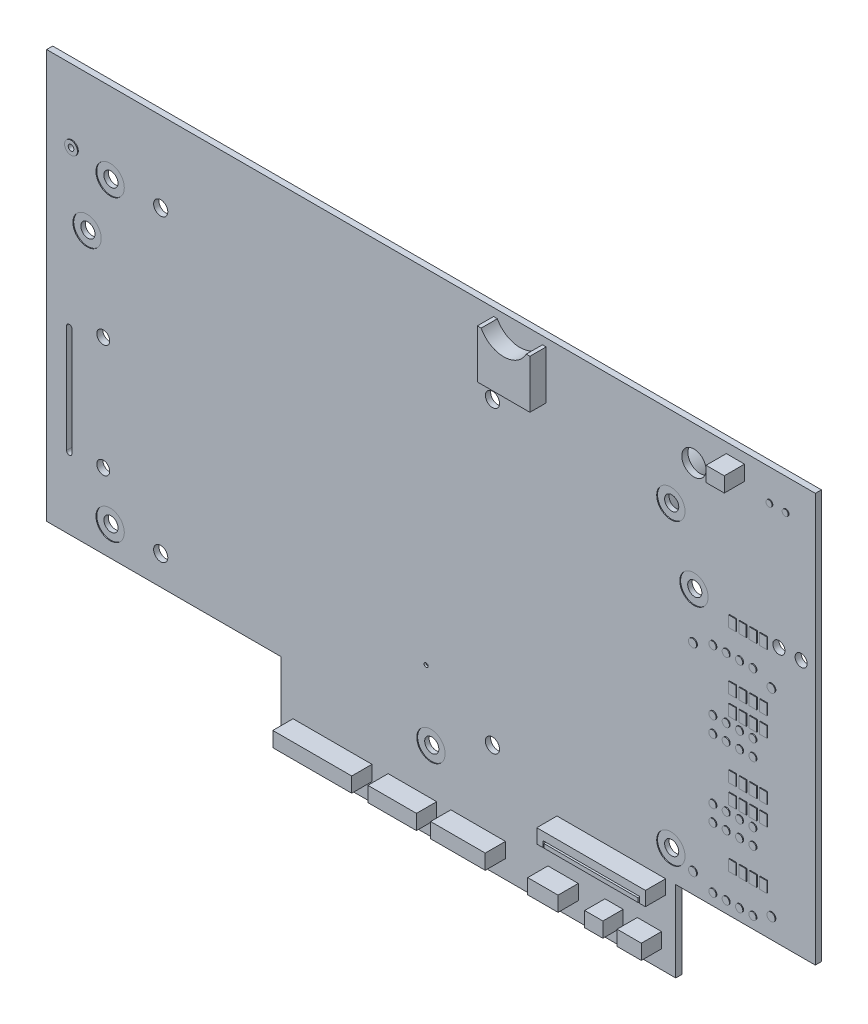
from build123d import *

# Parameters (mm, degrees)
BASE_EXTRUSION_DEPTH     = 1.5
ESQUISSE2_R              = 1.75
ENL_V_MAT_EXTRU_1_DEPTH  = 2
ESQUISSE5_R              = 1.75
ENL_V_MAT_EXTRU_2_DEPTH  = 3
ESQUISSE7_R              = 8
BOSS_EXTRU_1_DEPTH       = 14.5
ESQUISSE10_R             = 0.5
ENL_V_MAT_EXTRU_4_DEPTH  = 0.5
BOSS_EXTRU_6_DEPTH       = 4
ESQUISSE16_W             = 23.306113507
ESQUISSE16_H             = 1
BOSS_EXTRU_7_DEPTH       = 5
ESQUISSE17_R             = 8
ENL_V_MAT_EXTRU_6_DEPTH  = 0.2
ESQUISSE18_R             = 3.5
ENL_V_MAT_EXTRU_7_DEPTH  = 0.2
ENL_V_START              = -0.2
ESQUISSE19_R             = 3.5
ENL_V_MAT_EXTRU_8_DEPTH  = 0.2
ESQUISSE22_W             = 7.5
ESQUISSE22_H             = 3.7
ESQUISSE22_W_2           = 4.5
ESQUISSE22_W_3           = 6
ESQUISSE22_W_4           = 13.5
ESQUISSE22_W_5           = 12
ESQUISSE22_W_6           = 19.5
EXTRUSION1_DEPTH         = 5
ENL_V_MAT_EXTRU_11_DEPTH = 3
ESQUISSE29_R             = 0.9
EXTRUSION3_DEPTH         = 0.2
ESQUISSE31_W             = 1.8
ESQUISSE31_H             = 2.7
EXTRUSION4_DEPTH         = 0.2
ESQUISSE32_R             = 1
EXTRUSION5_DEPTH         = 0.2
ESQUISSE33_R             = 1.75
ENL_V_MAT_EXTRU_17_DEPTH = 4
ESQUISSE34_R             = 3.5
ENL_V_MAT_EXTRU_18_DEPTH = 0.2
ESQUISSE28_R             = 0.75
EXTRUSION7_DEPTH         = 0.2
ENL_V_MAT_EXTRU_19_DEPTH = 10
ESQUISSE37_R             = 1.6
EXTRUSION8_DEPTH         = 0.2
ESQUISSE38_R             = 0.7
ENL_V_MAT_EXTRU_20_DEPTH = 3
ESQUISSE39_R             = 1.6
ESQUISSE39_R_2           = 0.7
EXTRUSION9_DEPTH         = 0.2
ESQUISSE40_R             = 1.6
ENL_V_MAT_EXTRU_21_DEPTH = 10
ESQUISSE41_R             = 3
ENL_V_MAT_EXTRU_22_DEPTH = 10


with BuildPart() as part:
    # Esquisse1 → Base-Extrusion (new body)
    with BuildSketch(Plane.XY):
        Polygon((122.14228109, -27.413176144), (122.14228109, 73.586823856), (-67.85771891, 73.586823856), (-67.85771891, -27.413176144), (-9.945816536, -27.413176144), (-9.945816536, -47.413176144), (87.64228109, -47.413176144), (87.64228109, -27.413176144), align=None)
    extrude(amount=BASE_EXTRUSION_DEPTH)

    # Esquisse2 → Enlèv. mat.-Extru.1 (cut)
    with BuildSketch(Plane(origin=(0, 0, 0), x_dir=(-1, 0, 0), z_dir=(0, 0, -1))):
        with Locations((-86.44228109, 53.586823856)):
            Circle(ESQUISSE2_R)
        with Locations((52.15771891, 53.586823856)):
            Circle(ESQUISSE2_R)
        with Locations((52.15771891, -20.213176144)):
            Circle(ESQUISSE2_R)
        with Locations((-86.44228109, -20.213176144)):
            Circle(ESQUISSE2_R)
    extrude(amount=-ENL_V_MAT_EXTRU_1_DEPTH, mode=Mode.SUBTRACT)

    # Esquisse5 → Enlèv. mat.-Extru.2 (cut)
    with BuildSketch(Plane.XY.offset(1.5)):
        with Locations((92.14228109, 38.086823856)):
            Circle(ESQUISSE5_R)
        with Locations((-57.85771891, 39.836823856)):
            Circle(ESQUISSE5_R)
        with Locations((27.14228109, -27.913176144)):
            Circle(ESQUISSE5_R)
    extrude(amount=-ENL_V_MAT_EXTRU_2_DEPTH, mode=Mode.SUBTRACT)

    # Esquisse7 → Boss.-Extru.1 (add)
    with BuildSketch(Plane(origin=(0, 0, 0), x_dir=(-1, 0, 0), z_dir=(0, 0, -1))):
        with Locations(Location((-73.14228109, 46.086823856, 0), (0, 0, 180))):
            Circle(ESQUISSE7_R)
    extrude(amount=BOSS_EXTRU_1_DEPTH)

    # Esquisse10 → Enlèv. mat.-Extru.4 (cut)
    with BuildSketch(Plane.XY.offset(1.5)):
        with Locations((25.94228109, -11.285879107)):
            Circle(ESQUISSE10_R)
    extrude(amount=-ENL_V_MAT_EXTRU_4_DEPTH, mode=Mode.SUBTRACT)

    # Esquisse15 → Boss.-Extru.6 (add)
    with BuildSketch(Plane.XY.offset(1.5)):
        with BuildLine():
            Line((43.548575427, 71.657947326), (42.602098039, 71.657947326))
            Line((42.602098039, 71.657947326), (42.602098039, 59.657947326))
            Line((42.602098039, 59.657947326), (55.602098039, 59.657947326))
            Line((55.602098039, 59.657947326), (55.602098039, 71.657947326))
            Line((55.602098039, 71.657947326), (54.695803703, 71.657947326))
            ThreePointArc((54.695803703, 71.657947326), (49.122189565, 68.290516026), (43.548575427, 71.657947326))
        make_face()
    extrude(amount=BOSS_EXTRU_6_DEPTH)

    # Esquisse16 → Boss.-Extru.7 (add)
    with BuildSketch(Plane.XY.offset(1.5)):
        Polygon((58.29228109, -30.913176144), (59.79228109, -30.913176144), (59.79228109, -29.413176144), (83.64228109, -29.413176144), (83.64228109, -30.913176144), (85.14228109, -30.913176144), (85.14228109, -27.413176144), (58.29228109, -27.413176144), align=None)
        with Locations((71.70718325, -30.413176144)):
            Rectangle(ESQUISSE16_W, ESQUISSE16_H)
    extrude(amount=BOSS_EXTRU_7_DEPTH)

    # Esquisse17 → Enlèv. mat.-Extru.6 (cut)
    with BuildSketch(Plane(origin=(0, 0, 0), x_dir=(-1, 0, 0), z_dir=(0, 0, -1))):
        with Locations((-27.14228109, -24.413176144)):
            Circle(ESQUISSE17_R)
        with Locations((-92.14228109, 41.586823856)):
            Circle(ESQUISSE17_R)
        with Locations((57.85771891, 43.336823856)):
            Circle(ESQUISSE17_R)
    extrude(amount=-ENL_V_MAT_EXTRU_6_DEPTH, mode=Mode.SUBTRACT)

    # Esquisse18 → Enlèv. mat.-Extru.7 (cut)
    with BuildSketch(Plane(origin=(0, 0, 0), x_dir=(-1, 0, 0), z_dir=(0, 0, -1))):
        with Locations((-86.44228109, 53.586823856)):
            Circle(ESQUISSE18_R)
        with Locations((52.15771891, 53.586823856)):
            Circle(ESQUISSE18_R)
        with Locations((52.15771891, -20.213176144)):
            Circle(ESQUISSE18_R)
        with Locations((-86.44228109, -20.213176144)):
            Circle(ESQUISSE18_R)
    extrude(amount=-ENL_V_MAT_EXTRU_7_DEPTH, mode=Mode.SUBTRACT)

    # Esquisse19 → Enlèv. mat.-Extru.8 (cut)
    with BuildSketch(Plane.XY.offset(1.5).offset(ENL_V_START)):
        with Locations(Location((-52.15771891, 53.586823856, 0), (0, 0, 180))):
            Circle(ESQUISSE19_R)
        with Locations(Location((86.44228109, 53.586823856, 0), (0, 0, 180))):
            Circle(ESQUISSE19_R)
        with Locations((92.14228109, 38.086823856)):
            Circle(ESQUISSE19_R)
        with Locations(Location((86.44228109, -20.213176144, 0), (0, 0, 180))):
            Circle(ESQUISSE19_R)
        with Locations((27.14228109, -27.913176144)):
            Circle(ESQUISSE19_R)
        with Locations(Location((-52.15771891, -20.213176144, 0), (0, 0, 180))):
            Circle(ESQUISSE19_R)
        with Locations((-57.85771891, 39.836823856)):
            Circle(ESQUISSE19_R)
    extrude(amount=ENL_V_MAT_EXTRU_8_DEPTH, mode=Mode.SUBTRACT)

    # Esquisse22 → Extrusion1 (add)
    with BuildSketch(Plane.XY.offset(1.5)):
        with Locations((59.804183464, -41.063176144)):
            Rectangle(ESQUISSE22_W, ESQUISSE22_H)
        with Locations((102.39228109, 69.236823856)):
            Rectangle(ESQUISSE22_W_2, ESQUISSE22_H)
        with Locations((81.14228109, -41.063176144)):
            Rectangle(ESQUISSE22_W_3, ESQUISSE22_H)
        with Locations((38.804183464, -41.063176144)):
            Rectangle(ESQUISSE22_W_4, ESQUISSE22_H)
        with Locations((72.39228109, -41.063176144)):
            Rectangle(ESQUISSE22_W_2, ESQUISSE22_H)
        with Locations((22.554183464, -41.063176144)):
            Rectangle(ESQUISSE22_W_5, ESQUISSE22_H)
        with Locations((2.804183464, -41.063176144)):
            Rectangle(ESQUISSE22_W_6, ESQUISSE22_H)
    extrude(amount=EXTRUSION1_DEPTH)

    # Esquisse24 → Enlèv. mat.-Extru.11 (cut)
    with BuildSketch(Plane.XY.offset(1.5)):
        with BuildLine():
            ThreePointArc((113.14228109, 37.586823856), (111.64228109, 36.086823856), (113.14228109, 34.586823856))
            ThreePointArc((113.14228109, 34.586823856), (114.64228109, 36.086823856), (113.14228109, 37.586823856))
        make_face()
        with BuildLine():
            ThreePointArc((118.64228109, 34.586823856), (120.14228109, 36.086823856), (118.64228109, 37.586823856))
            ThreePointArc((118.64228109, 37.586823856), (117.14228109, 36.086823856), (118.64228109, 34.586823856))
        make_face()
    extrude(amount=-ENL_V_MAT_EXTRU_11_DEPTH, mode=Mode.SUBTRACT)

    # Esquisse29 → Extrusion3 (add)
    with BuildSketch(Plane.XY.offset(1.5)):
        with Locations((96.911707381, 28.536823856)):
            Circle(ESQUISSE29_R)
        with Locations((100.211707381, 28.536823856)):
            Circle(ESQUISSE29_R)
        with Locations((103.511707381, 28.536823856)):
            Circle(ESQUISSE29_R)
        with Locations((106.811707381, 28.536823856)):
            Circle(ESQUISSE29_R)
        with Locations((96.911707381, 13.536823856)):
            Circle(ESQUISSE29_R)
        with Locations((100.211707381, 13.536823856)):
            Circle(ESQUISSE29_R)
        with Locations((103.511707381, 13.536823856)):
            Circle(ESQUISSE29_R)
        with Locations((106.811707381, 13.536823856)):
            Circle(ESQUISSE29_R)
        with Locations((96.911707381, 9.536823856)):
            Circle(ESQUISSE29_R)
        with Locations((100.211707381, 9.536823856)):
            Circle(ESQUISSE29_R)
        with Locations((103.511707381, 9.536823856)):
            Circle(ESQUISSE29_R)
        with Locations((106.811707381, 9.536823856)):
            Circle(ESQUISSE29_R)
        with Locations((96.911707381, -5.463176144)):
            Circle(ESQUISSE29_R)
        with Locations((100.211707381, -5.463176144)):
            Circle(ESQUISSE29_R)
        with Locations((103.511707381, -5.463176144)):
            Circle(ESQUISSE29_R)
        with Locations((106.811707381, -5.463176144)):
            Circle(ESQUISSE29_R)
        with Locations((96.911707381, -9.463176144)):
            Circle(ESQUISSE29_R)
        with Locations((100.211707381, -9.463176144)):
            Circle(ESQUISSE29_R)
        with Locations((103.511707381, -9.463176144)):
            Circle(ESQUISSE29_R)
        with Locations((106.811707381, -9.463176144)):
            Circle(ESQUISSE29_R)
        with Locations((96.911707381, -24.463176144)):
            Circle(ESQUISSE29_R)
        with Locations((100.211707381, -24.463176144)):
            Circle(ESQUISSE29_R)
        with Locations((103.511707381, -24.463176144)):
            Circle(ESQUISSE29_R)
        with Locations((106.811707381, -24.463176144)):
            Circle(ESQUISSE29_R)
    extrude(amount=EXTRUSION3_DEPTH)

    # Esquisse31 → Extrusion4 (add)
    with BuildSketch(Plane.XY.offset(1.5)):
        with Locations((101.82228109, -2.310761678)):
            Rectangle(ESQUISSE31_W, ESQUISSE31_H)
        with Locations((104.36228109, -2.310761678)):
            Rectangle(ESQUISSE31_W, ESQUISSE31_H)
        with Locations((106.90228109, -2.310761678)):
            Rectangle(ESQUISSE31_W, ESQUISSE31_H)
        with Locations((109.44228109, -2.310761678)):
            Rectangle(ESQUISSE31_W, ESQUISSE31_H)
        with Locations((101.82228109, -16.510761678)):
            Rectangle(ESQUISSE31_W, ESQUISSE31_H)
        with Locations((104.36228109, -16.510761678)):
            Rectangle(ESQUISSE31_W, ESQUISSE31_H)
        with Locations((106.90228109, -16.510761678)):
            Rectangle(ESQUISSE31_W, ESQUISSE31_H)
        with Locations((109.44228109, -16.510761678)):
            Rectangle(ESQUISSE31_W, ESQUISSE31_H)
        with Locations((101.82228109, 16.689238322)):
            Rectangle(ESQUISSE31_W, ESQUISSE31_H)
        with Locations((104.36228109, 16.689238322)):
            Rectangle(ESQUISSE31_W, ESQUISSE31_H)
        with Locations((106.90228109, 16.689238322)):
            Rectangle(ESQUISSE31_W, ESQUISSE31_H)
        with Locations((109.44228109, 16.689238322)):
            Rectangle(ESQUISSE31_W, ESQUISSE31_H)
        with Locations((101.82228109, 2.489238322)):
            Rectangle(ESQUISSE31_W, ESQUISSE31_H)
        with Locations((104.36228109, 2.489238322)):
            Rectangle(ESQUISSE31_W, ESQUISSE31_H)
        with Locations((106.90228109, 2.489238322)):
            Rectangle(ESQUISSE31_W, ESQUISSE31_H)
        with Locations((109.44228109, 2.489238322)):
            Rectangle(ESQUISSE31_W, ESQUISSE31_H)
        with Locations((101.82228109, 35.689238322)):
            Rectangle(ESQUISSE31_W, ESQUISSE31_H)
        with Locations((104.36228109, 35.689238322)):
            Rectangle(ESQUISSE31_W, ESQUISSE31_H)
        with Locations((106.90228109, 35.689238322)):
            Rectangle(ESQUISSE31_W, ESQUISSE31_H)
        with Locations((109.44228109, 35.689238322)):
            Rectangle(ESQUISSE31_W, ESQUISSE31_H)
        with Locations((101.82228109, 21.489238322)):
            Rectangle(ESQUISSE31_W, ESQUISSE31_H)
        with Locations((104.36228109, 21.489238322)):
            Rectangle(ESQUISSE31_W, ESQUISSE31_H)
        with Locations((106.90228109, 21.489238322)):
            Rectangle(ESQUISSE31_W, ESQUISSE31_H)
        with Locations((109.44228109, 21.489238322)):
            Rectangle(ESQUISSE31_W, ESQUISSE31_H)
    extrude(amount=EXTRUSION4_DEPTH)

    # Esquisse32 → Extrusion5 (add)
    with BuildSketch(Plane.XY.offset(1.5)):
        with Locations((91.997119169, 26.572311988)):
            Circle(ESQUISSE32_R)
        with Locations((111.387112787, 26.572311988)):
            Circle(ESQUISSE32_R)
        with Locations((91.993745918, -22.355969861)):
            Circle(ESQUISSE32_R)
        with Locations((111.387112787, -22.355969861)):
            Circle(ESQUISSE32_R)
    extrude(amount=EXTRUSION5_DEPTH)

    # Esquisse33 → Enlèv. mat.-Extru.17 (cut)
    with BuildSketch(Plane(origin=(0, 0, 0), x_dir=(-1, 0, 0), z_dir=(0, 0, -1))):
        with Locations((-42.34228109, -20.213176144)):
            Circle(ESQUISSE33_R)
        with Locations((-42.34228109, 53.786823856)):
            Circle(ESQUISSE33_R)
        with Locations((39.65771891, -20.213176144)):
            Circle(ESQUISSE33_R)
        with Locations((39.65771891, 53.786823856)):
            Circle(ESQUISSE33_R)
    extrude(amount=-ENL_V_MAT_EXTRU_17_DEPTH, mode=Mode.SUBTRACT)

    # Esquisse34 → Enlèv. mat.-Extru.18 (cut)
    with BuildSketch(Plane(origin=(0, 0, 0), x_dir=(-1, 0, 0), z_dir=(0, 0, -1))):
        with Locations((-42.34228109, 53.786823856)):
            Circle(ESQUISSE34_R)
        with Locations((-42.34228109, -20.213176144)):
            Circle(ESQUISSE34_R)
        with Locations((39.65771891, -20.213176144)):
            Circle(ESQUISSE34_R)
        with Locations((39.65771891, 53.786823856)):
            Circle(ESQUISSE34_R)
    extrude(amount=-ENL_V_MAT_EXTRU_18_DEPTH, mode=Mode.SUBTRACT)

    # Esquisse28 → Extrusion7 (add)
    with BuildSketch(Plane.XY.offset(1.5)):
        with Locations((110.89228109, 65.886823856)):
            Circle(ESQUISSE28_R)
        with Locations((114.89228109, 65.886823856)):
            Circle(ESQUISSE28_R)
    extrude(amount=EXTRUSION7_DEPTH)

    # Esquisse36 → Enlèv. mat.-Extru.19 (cut)
    with BuildSketch(Plane.XY.offset(1.5)):
        with BuildLine():
            Line((-62.93271891, 16.886823856), (-62.93271891, -9.763176144))
            ThreePointArc((-62.93271891, -9.763176144), (-62.25771891, -10.438176144), (-61.58271891, -9.763176144))
            Line((-61.58271891, -9.763176144), (-61.58271891, 16.886823856))
            ThreePointArc((-61.58271891, 16.886823856), (-62.25771891, 17.561823856), (-62.93271891, 16.886823856))
        make_face()
    extrude(amount=-ENL_V_MAT_EXTRU_19_DEPTH, mode=Mode.SUBTRACT)

    # Esquisse37 → Extrusion8 (add)
    with BuildSketch(Plane(origin=(0, 0, 0), x_dir=(-1, 0, 0), z_dir=(0, 0, -1))):
        with Locations(Location((61.623866785, 55.7785751, 0), (0, 0, 180))):
            Circle(ESQUISSE37_R)
    extrude(amount=EXTRUSION8_DEPTH)

    # Esquisse38 → Enlèv. mat.-Extru.20 (cut)
    with BuildSketch(Plane(origin=(0, 0, -0.2), x_dir=(-1, 0, 0), z_dir=(0, 0, -1))):
        with Locations((61.623866785, 55.7785751)):
            Circle(ESQUISSE38_R)
    extrude(amount=-ENL_V_MAT_EXTRU_20_DEPTH, mode=Mode.SUBTRACT)

    # Esquisse39 → Extrusion9 (add)
    with BuildSketch(Plane.XY.offset(1.5)):
        with Locations((-61.623866785, 55.7785751)):
            Circle(ESQUISSE39_R)
        with Locations(Location((-61.623866785, 55.7785751, 0), (0, 0, 180))):
            Circle(ESQUISSE39_R_2, mode=Mode.SUBTRACT)
    extrude(amount=EXTRUSION9_DEPTH)

    # Esquisse40 → Enlèv. mat.-Extru.21 (cut)
    with BuildSketch(Plane(origin=(0, 0, 0), x_dir=(-1, 0, 0), z_dir=(0, 0, -1))):
        with Locations((53.85771891, 18.986823856)):
            Circle(ESQUISSE40_R)
        with Locations((53.85771891, -8.913176144)):
            Circle(ESQUISSE40_R)
    extrude(amount=-ENL_V_MAT_EXTRU_21_DEPTH, mode=Mode.SUBTRACT)

    # Esquisse41 → Enlèv. mat.-Extru.22 (cut)
    with BuildSketch(Plane.XY.offset(1.5)):
        with Locations((92.14228109, 65.086823856)):
            Circle(ESQUISSE41_R)
    extrude(amount=-ENL_V_MAT_EXTRU_22_DEPTH, mode=Mode.SUBTRACT)


solid = part.part
